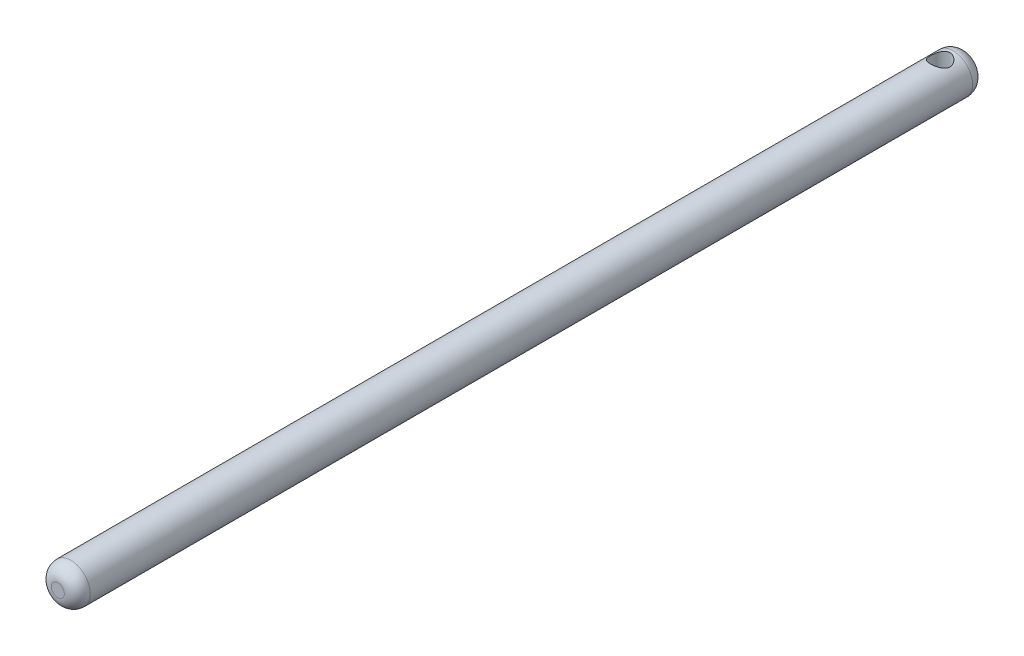
from build123d import *

# Parameters (mm, degrees)
SKETCH3_R                       = 2.38125
BOSS_EXTRUDE1_DEPTH             = 55.5625
FILLET2_R                       = 1.5875
F_3_32_0_09375_DIAMETER_HOLE3_D = 2.38125
FILLET3_R                       = 1.5875


with BuildPart() as part:
    # Sketch3 → Boss-Extrude1 (new, symmetric)
    with BuildSketch(Plane.XY):
        Circle(SKETCH3_R)
    extrude(amount=BOSS_EXTRUDE1_DEPTH, both=True)

    # Fillet2
    fillet2_edges = [part.edges().sort_by_distance(p)[0] for p in [
        (-2.38125, 0, 55.5625),
    ]]
    fillet(fillet2_edges, radius=FILLET2_R)

    # 3/32 (0.09375) Diameter Hole3 (through all)
    with Locations(Plane(origin=(0, 2.38125, 0), x_dir=(1, 0, 0), z_dir=(0, 1, 0))):
        with Locations((0, 52.3875)):
            Hole(F_3_32_0_09375_DIAMETER_HOLE3_D / 2)

    # Fillet3
    fillet3_edges = [part.edges().sort_by_distance(p)[0] for p in [
        (-2.38125, 0, -55.5625),
    ]]
    fillet(fillet3_edges, radius=FILLET3_R)


solid = part.part
